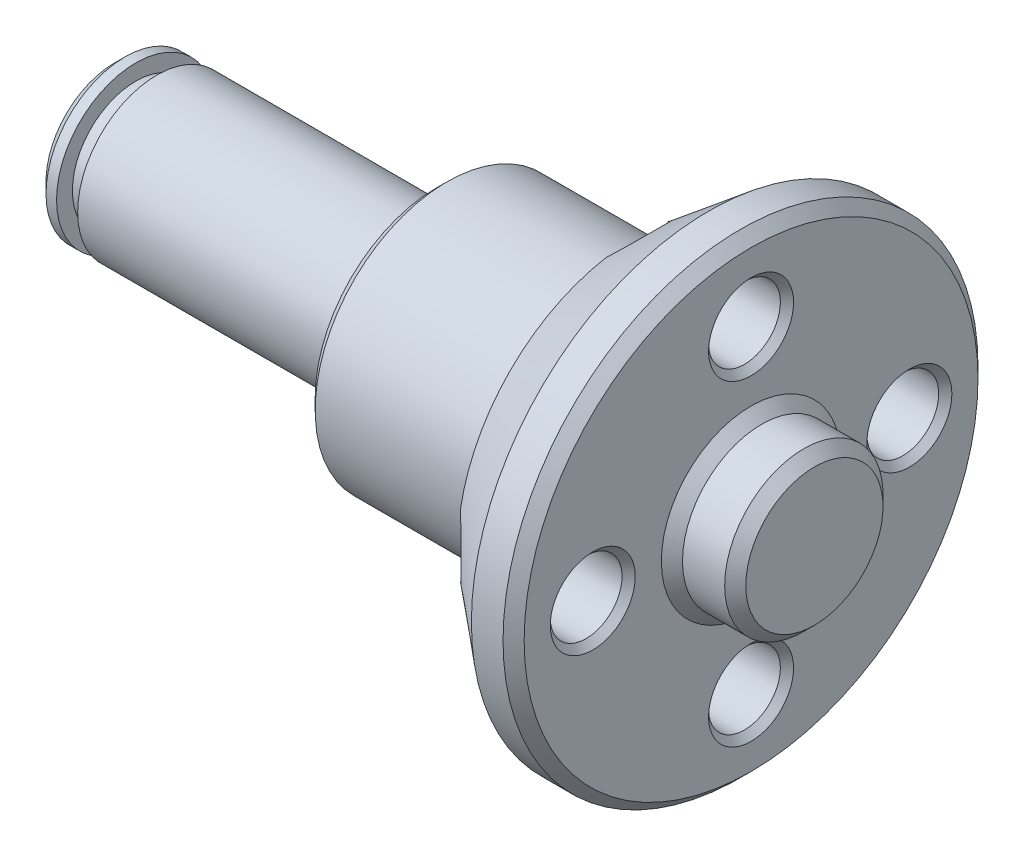
from build123d import *

# Parameters (mm, degrees)
CHAMFER1_SIZE               = 1
M8_TAPPED_HOLE1_D           = 6.8
M8_TAPPED_HOLE1_DEPTH       = 12
M8_TAPPED_HOLE1_CSINK_D     = 8.05
M8_TAPPED_HOLE1_CSINK_ANGLE = 90
M8_TAPPED_HOLE1_TIP         = 2.042926105


with BuildPart() as part:
    # Sketch1 → Revolve1 (revolve)
    with BuildSketch(Plane.XY, mode=Mode.PRIVATE) as revolve1_sk:
        Polygon((0, 0), (0, 7.5), (2, 7.5), (2, 6), (4, 6), (4, 7.5), (30.5, 7.5), (30.5, 12.5), (49.5, 12.5), (49.5, 17), (56.3, 22.5), (60.3, 22.5), (60.3, 7.5), (66.3, 7.5), (66.3, 0), align=None)
    revolve(revolve1_sk.sketch.rotate(Axis((-14.460784314, 0, 0), (1, 0, 0)), 90), axis=Axis((-14.460784314, 0, 0), (1, 0, 0)))

    # Chamfer1
    chamfer1_edges = [part.edges().sort_by_distance(p)[0] for p in [
        (66.3, 0, -7.5),
        (60.3, 0, -7.5),
        (60.3, 0, -22.5),
        (49.5, 0, -12.5),
        (30.5, 0, -12.5),
        (30.5, 0, -7.5),
        (0, 0, -7.5),
    ]]
    chamfer(chamfer1_edges, length=CHAMFER1_SIZE)

    # M8 Tapped Hole1
    with Locations(Plane(origin=(60.3, 0, 0), x_dir=(0, 0, -1), z_dir=(1, 0, 0))):
        with Locations((0, 15), (15, 0), (-15, 0), (0, -15)):
            CounterSinkHole(M8_TAPPED_HOLE1_D / 2, M8_TAPPED_HOLE1_CSINK_D / 2, depth=M8_TAPPED_HOLE1_DEPTH, counter_sink_angle=M8_TAPPED_HOLE1_CSINK_ANGLE)
            with Locations((0, 0, -(M8_TAPPED_HOLE1_DEPTH + M8_TAPPED_HOLE1_TIP / 2))):  # 118° drill point
                Cone(0, M8_TAPPED_HOLE1_D / 2, M8_TAPPED_HOLE1_TIP, mode=Mode.SUBTRACT)


solid = part.part
